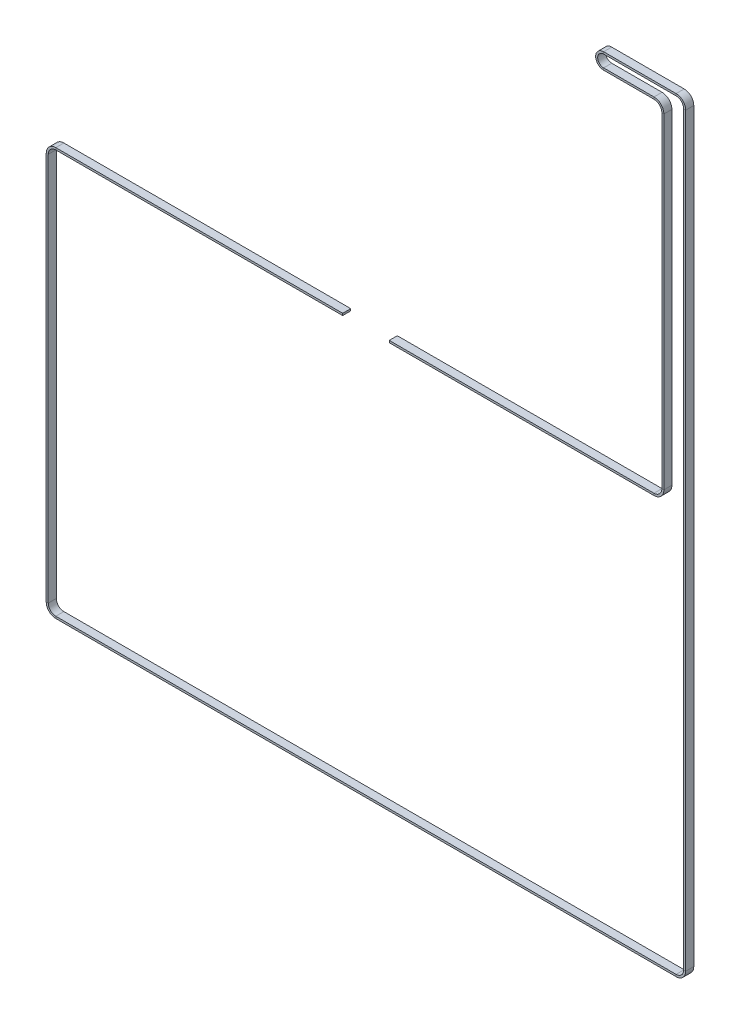
from build123d import *

# Parameters (mm, degrees)
SKETCH4_W = 6
SKETCH4_H = 1.5


with BuildPart() as part:
    # Sweep1: sweep along a path in Sketch1
    with BuildLine(Plane.XY.offset(2.2)) as sweep1_path:
        Line((182.962225959, -408.135411885), (-30.687774041, -408.135411885))
        ThreePointArc((-30.687774041, -408.135411885), (-35.195579771, -410.002606155), (-37.062774041, -414.510411885))
        Line((-37.062774041, -414.510411885), (-37.062774041, -703.985411885))
        ThreePointArc((-37.062774041, -703.985411885), (-35.195579771, -708.493217615), (-30.687774041, -710.360411885))
        Line((-30.687774041, -710.360411885), (431.312225959, -710.360411885))
        ThreePointArc((431.312225959, -710.360411885), (435.820031689, -708.493217615), (437.687225959, -703.985411885))
        Line((437.687225959, -703.985411885), (437.687225959, -148.660411885))
        ThreePointArc((437.687225959, -148.660411885), (435.820031689, -144.152606155), (431.312225959, -142.285411885))
        Line((431.312225959, -142.285411885), (377.312225959, -142.285411885))
        ThreePointArc((377.312225959, -142.285411885), (372.112225959, -147.485411885), (377.312225959, -152.685411885))
        Line((377.312225959, -152.685411885), (414.812225959, -152.685411885))
        ThreePointArc((414.812225959, -152.685411885), (419.479130714, -154.618507129), (421.412225959, -159.285411885))
        Line((421.412225959, -159.285411885), (421.412225959, -401.685411885))
        ThreePointArc((421.412225959, -401.685411885), (419.479130714, -406.352316641), (414.812225959, -408.285411885))
        Line((414.812225959, -408.285411885), (217.662225959, -408.285411885))
    # Sketch4 → Sweep1 (sweep)
    with BuildSketch(Plane(origin=(182.962225959, -408.135411885, 2.2), x_dir=(0, 0, -1), z_dir=(1, 0, 0))):
        Rectangle(SKETCH4_W, SKETCH4_H)
    sweep(path=sweep1_path.line)


solid = part.part
